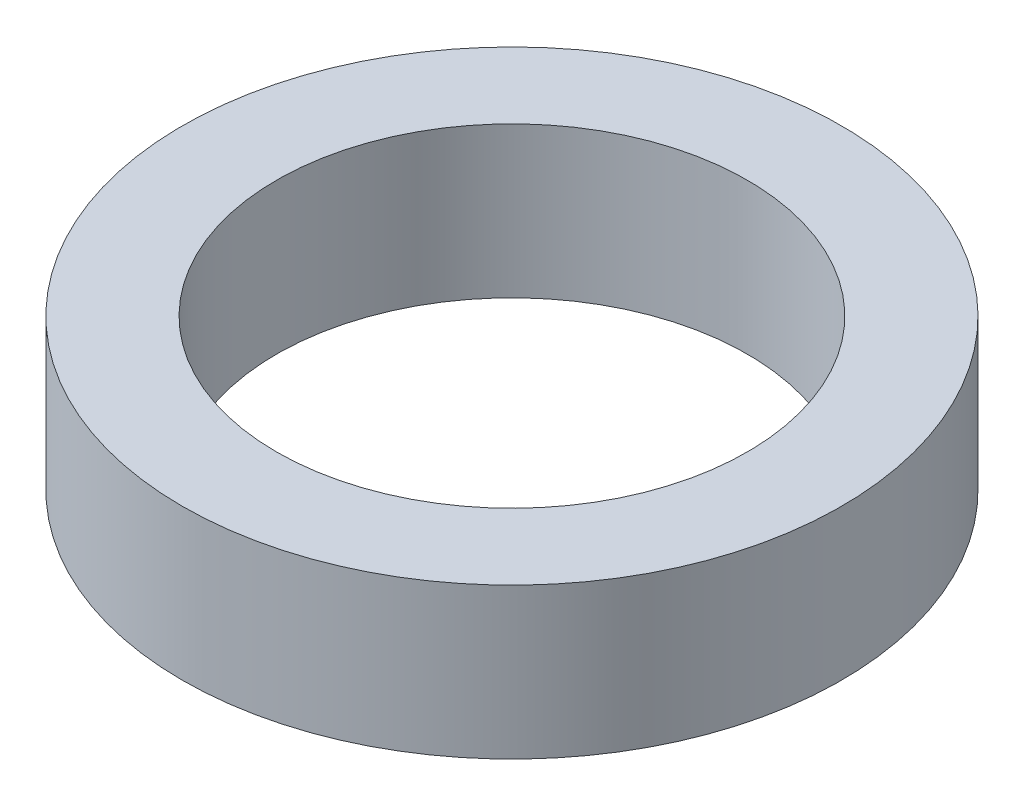
from build123d import *

# Parameters (mm, degrees)
SKETCH1_R           = 5.55625
SKETCH1_R_2         = 3.96875
BOSS_EXTRUDE1_DEPTH = 2.54


with BuildPart() as part:
    # Sketch1 → Boss-Extrude1 (new body)
    with BuildSketch(Plane(origin=(0, 0, 0), x_dir=(1, 0, 0), z_dir=(0, 1, 0))):
        with Locations(Location((0, 0, 0), (0, 0, 270))):
            Circle(SKETCH1_R)
        with Locations(Location((0, 0, 0), (0, 0, 270))):
            Circle(SKETCH1_R_2, mode=Mode.SUBTRACT)
    extrude(amount=BOSS_EXTRUDE1_DEPTH)


solid = part.part
